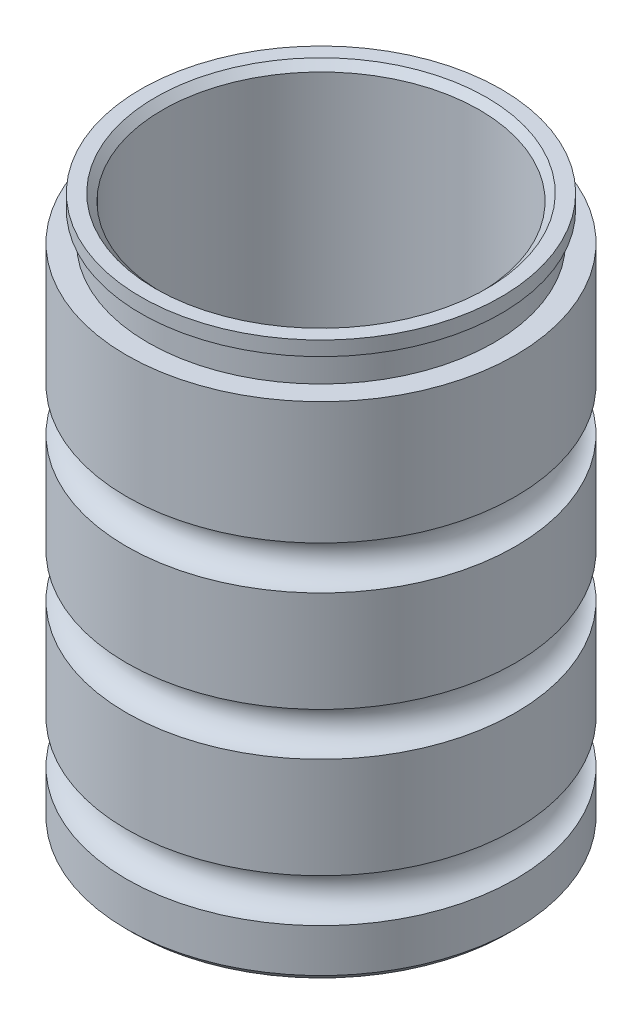
from build123d import *

# Parameters (mm, degrees)
ESQUISSE2_R             = 2.5
ENL_V_MAT_EXTRU_1_DEPTH = 10
ESQUISSE4_R             = 2
ENL_V_MAT_EXTRU_3_DEPTH = 43.52646235
CHANFREIN4_SIZE         = 0.5
CHANFREIN2_SIZE         = 0.5
CHANFREIN3_SIZE         = 0.5


with BuildPart() as part:
    # Esquisse1 → Révolution1 (revolve)
    with BuildSketch(Plane.XY, mode=Mode.PRIVATE) as r_volution1_sk:
        with BuildLine():
            Line((0, 0), (-13.5, 0))
            Line((-13.5, 0), (-13.5, 3.5))
            ThreePointArc((-13.5, 3.5), (-12, 5), (-13.5, 6.5))
            Line((-13.5, 6.5), (-13.5, 13.5))
            ThreePointArc((-13.5, 13.5), (-12, 15), (-13.5, 16.5))
            Line((-13.5, 16.5), (-13.5, 23.5))
            ThreePointArc((-13.5, 23.5), (-12, 25), (-13.5, 26.5))
            Line((-13.5, 26.5), (-13.5, 35))
            Line((-13.5, 35), (-12.5, 35))
            Line((-12.5, 35), (-12, 35))
            Line((-12, 35), (-12, 37))
            Line((-12, 37), (-12.5, 37))
            Line((-12.5, 37), (-12.5, 38))
            Line((-12.5, 38), (-11, 38))
            Line((-11, 38), (-11, 33))
            Line((-11, 33), (-11, 12))
            Line((-11, 12), (0, 12))
            Line((0, 12), (0, 3))
            Line((0, 3), (0, 0))
        make_face()
    revolve(r_volution1_sk.sketch.rotate(Axis((0, -29.115408637, 0), (0, 1, 0)), 270), axis=Axis((0, -29.115408637, 0), (0, 1, 0)))

    # Esquisse2 → Enlèv. mat.-Extru.1 (cut)
    with BuildSketch(Plane.XZ):
        with Locations(Location((8, 0, 0), (0, 0, 270))):
            Circle(ESQUISSE2_R)
        with Locations(Location((-8, 0, 0), (0, 0, 270))):
            Circle(ESQUISSE2_R)
    extrude(amount=-ENL_V_MAT_EXTRU_1_DEPTH, mode=Mode.SUBTRACT)

    # Esquisse4 → Enlèv. mat.-Extru.3 (cut, through all)
    with BuildSketch(Plane.XZ):
        with Locations(Location((0, 0, 0), (0, 0, 270))):
            Circle(ESQUISSE4_R)
    extrude(amount=-ENL_V_MAT_EXTRU_3_DEPTH, mode=Mode.SUBTRACT)

    # Chanfrein4
    chanfrein4_edges = [part.edges().sort_by_distance(p)[0] for p in [
        (0, 12, 2),
        (0, 0, 2),
    ]]
    chamfer(chanfrein4_edges, length=CHANFREIN4_SIZE)

    # Chanfrein2
    chanfrein2_edges = [part.edges().sort_by_distance(p)[0] for p in [
        (8, 0, 2.5),
        (-8, 0, 2.5),
    ]]
    chamfer(chanfrein2_edges, length=CHANFREIN2_SIZE)

    # Chanfrein3
    chanfrein3_edges = [part.edges().sort_by_distance(p)[0] for p in [
        (0, 38, 11),
        (0, 0, 13.5),
    ]]
    chamfer(chanfrein3_edges, length=CHANFREIN3_SIZE)


solid = part.part
